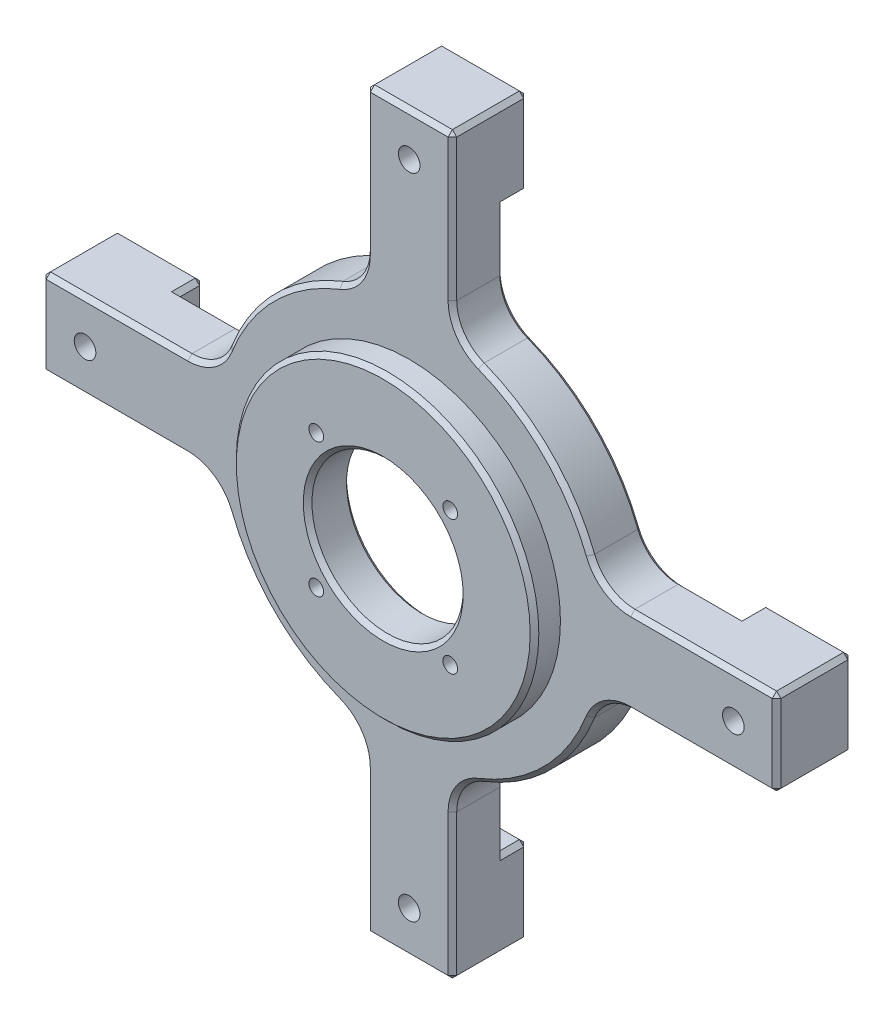
from build123d import *

# Parameters (mm, degrees)
SKETCH1_R                                           = 35
BOSS_EXTRUDE1_DEPTH                                 = 12
BOSS_EXTRUDE2_START                                 = -4
SKETCH2_R                                           = 35
SKETCH2_R_2                                         = 17.5
BOSS_EXTRUDE2_DEPTH                                 = 4
SKETCH3_W                                           = 20
SKETCH3_H                                           = 20
BOSS_EXTRUDE3_DEPTH                                 = 5.5
CIRPATTERN1_COUNT                                   = 4
CUT_EXTRUDE1_REACH                                  = 123.475
SKETCH4_R                                           = 2.5
FILLET2_R                                           = 10
SKETCH5_R                                           = 35
SKETCH5_R_2                                         = 17.5
BOSS_EXTRUDE4_DEPTH                                 = 6
CSK_FOR_M3_COUNTERSUNK_FLAT_HEAD_SCREW1_D           = 3.4
CSK_FOR_M3_COUNTERSUNK_FLAT_HEAD_SCREW1_CSINK_D     = 6.3
CSK_FOR_M3_COUNTERSUNK_FLAT_HEAD_SCREW1_CSINK_ANGLE = 90
CHAMFER1_SIZE                                       = 1
CHAMFER2_SIZE                                       = 1


with BuildPart() as part:
    # Sketch1 → Boss-Extrude1 (new body)
    with BuildSketch(Plane.XY):
        with BuildLine():
            Line((43.874821937, -10), (85, -10))
            Line((85, -10), (85, 10))
            Line((85, 10), (43.874821937, 10))
            ThreePointArc((43.874821937, 10), (31.819805153, 31.819805153), (10, 43.874821937))
            Line((10, 43.874821937), (10, 85))
            Line((10, 85), (-10, 85))
            Line((-10, 85), (-10, 43.874821937))
            ThreePointArc((-10, 43.874821937), (-31.819805153, 31.819805153), (-43.874821937, 10))
            Line((-43.874821937, 10), (-85, 10))
            Line((-85, 10), (-85, -10))
            Line((-85, -10), (-43.874821937, -10))
            ThreePointArc((-43.874821937, -10), (-31.819805153, -31.819805153), (-10, -43.874821937))
            Line((-10, -43.874821937), (-10, -85))
            Line((-10, -85), (10, -85))
            Line((10, -85), (10, -43.874821937))
            ThreePointArc((10, -43.874821937), (31.819805153, -31.819805153), (43.874821937, -10))
        make_face()
        Circle(SKETCH1_R, mode=Mode.SUBTRACT)
    extrude(amount=BOSS_EXTRUDE1_DEPTH)

    # Sketch2 → Boss-Extrude2 (add)
    with BuildSketch(Plane.XY.offset(12).offset(BOSS_EXTRUDE2_START)):
        Circle(SKETCH2_R)
        Circle(SKETCH2_R_2, mode=Mode.SUBTRACT)
    extrude(amount=BOSS_EXTRUDE2_DEPTH)

    # Sketch3 → Boss-Extrude3 (add)
    with BuildSketch(Plane.XY):
        with Locations((0, 75)):
            Rectangle(SKETCH3_W, SKETCH3_H)
    boss_extrude3 = extrude(amount=-BOSS_EXTRUDE3_DEPTH)

    # CirPattern1: Boss-Extrude3 ×4 about axis
    cirpattern1_axis = Axis((0, 0, 0), (0, 0, 1))
    for i in range(1, CIRPATTERN1_COUNT):
        add(boss_extrude3.rotate(cirpattern1_axis, i * 360 / CIRPATTERN1_COUNT))

    # Sketch4 → Cut-Extrude1 (cut, up to next)
    with BuildSketch(Plane(origin=(0, 0, -5.5), x_dir=(-1, 0, 0), z_dir=(0, 0, -1)), mode=Mode.PRIVATE) as cut_extrude1_sk1:
        with Locations((0, 75)):
            Circle(SKETCH4_R)
    cut_extrude1_tool1 = extrude(cut_extrude1_sk1.sketch, amount=-CUT_EXTRUDE1_REACH, mode=Mode.PRIVATE) & part.part
    # Sketch4 → Cut-Extrude1 (cut, up to next)
    with BuildSketch(Plane(origin=(0, 0, -5.5), x_dir=(-1, 0, 0), z_dir=(0, 0, -1)), mode=Mode.PRIVATE) as cut_extrude1_sk2:
        with Locations((-75, 0)):
            Circle(SKETCH4_R)
    cut_extrude1_tool2 = extrude(cut_extrude1_sk2.sketch, amount=-CUT_EXTRUDE1_REACH, mode=Mode.PRIVATE) & part.part
    # Sketch4 → Cut-Extrude1 (cut, up to next)
    with BuildSketch(Plane(origin=(0, 0, -5.5), x_dir=(-1, 0, 0), z_dir=(0, 0, -1)), mode=Mode.PRIVATE) as cut_extrude1_sk3:
        with Locations((0, -75)):
            Circle(SKETCH4_R)
    cut_extrude1_tool3 = extrude(cut_extrude1_sk3.sketch, amount=-CUT_EXTRUDE1_REACH, mode=Mode.PRIVATE) & part.part
    # Sketch4 → Cut-Extrude1 (cut, up to next)
    with BuildSketch(Plane(origin=(0, 0, -5.5), x_dir=(-1, 0, 0), z_dir=(0, 0, -1)), mode=Mode.PRIVATE) as cut_extrude1_sk4:
        with Locations((75, 0)):
            Circle(SKETCH4_R)
    cut_extrude1_tool4 = extrude(cut_extrude1_sk4.sketch, amount=-CUT_EXTRUDE1_REACH, mode=Mode.PRIVATE) & part.part
    add(cut_extrude1_tool1.solids().sort_by_distance((0, 75, -5.5))[0], mode=Mode.SUBTRACT)
    add(cut_extrude1_tool2.solids().sort_by_distance((75, 0, -5.5))[0], mode=Mode.SUBTRACT)
    add(cut_extrude1_tool3.solids().sort_by_distance((0, -75, -5.5))[0], mode=Mode.SUBTRACT)
    add(cut_extrude1_tool4.solids().sort_by_distance((-75, 0, -5.5))[0], mode=Mode.SUBTRACT)

    # Fillet2
    fillet2_edges = [part.edges().sort_by_distance(p)[0] for p in [
        (10, -43.874821937, 6),
        (-10, -43.874821937, 6),
        (-43.874821937, -10, 6),
        (-43.874821937, 10, 6),
        (-10, 43.874821937, 6),
        (10, 43.874821937, 6),
        (43.874821937, 10, 6),
        (43.874821937, -10, 6),
    ]]
    fillet(fillet2_edges, radius=FILLET2_R)

    # Sketch5 → Boss-Extrude4 (add)
    with BuildSketch(Plane.XY.offset(12)):
        Circle(SKETCH5_R)
        Circle(SKETCH5_R_2, mode=Mode.SUBTRACT)
    extrude(amount=BOSS_EXTRUDE4_DEPTH)

    # CSK for M3 Countersunk Flat Head Screw1 (through all)
    with Locations(Plane(origin=(-15.5, 15.5, 8), x_dir=(-1, 0, 0), z_dir=(0, 0, -1))):
        with Locations((0, 0), (-31, 0), (-31, -31), (0, -31)):
            CounterSinkHole(CSK_FOR_M3_COUNTERSUNK_FLAT_HEAD_SCREW1_D / 2, CSK_FOR_M3_COUNTERSUNK_FLAT_HEAD_SCREW1_CSINK_D / 2, counter_sink_angle=CSK_FOR_M3_COUNTERSUNK_FLAT_HEAD_SCREW1_CSINK_ANGLE)

    # Chamfer1
    chamfer1_edges = [part.edges().sort_by_distance(p)[0] for p in [
        (85, 0, 12),
        (-58.117376915, 10, 0),
        (-68.117376915, 10, 12),
        (-31.819805153, 31.819805153, 0),
        (-31.819805153, 31.819805153, 12),
        (-31.819805153, -31.819805153, 0),
        (-31.819805153, -31.819805153, 12),
        (68.117376915, 10, 12),
        (-10, -58.117376915, 0),
        (-10, -68.117376915, 12),
        (31.819805153, -31.819805153, 0),
        (31.819805153, -31.819805153, 12),
        (58.117376915, -10, 0),
        (68.117376915, -10, 12),
        (31.819805153, 31.819805153, 0),
        (31.819805153, 31.819805153, 12),
        (10, 58.117376915, 0),
        (10, 68.117376915, 12),
        (-45.593993082, 11.742771762, 0),
        (-45.593993082, 11.742771762, 12),
        (-11.742771762, 45.593993082, 0),
        (-11.742771762, 45.593993082, 12),
        (-45.593993082, -11.742771762, 0),
        (-45.593993082, -11.742771762, 12),
        (-11.742771762, -45.593993082, 0),
        (-11.742771762, -45.593993082, 12),
        (11.742771762, -45.593993082, 0),
        (11.742771762, -45.593993082, 12),
        (45.593993082, -11.742771762, 0),
        (45.593993082, -11.742771762, 12),
        (45.593993082, 11.742771762, 0),
        (45.593993082, 11.742771762, 12),
        (11.742771762, 45.593993082, 0),
        (11.742771762, 45.593993082, 12),
        (0, 85, 12),
        (-10, 68.117376915, 12),
        (10, -85, 3.25),
        (-10, -85, 3.25),
        (-85, -10, 3.25),
        (-85, 10, 3.25),
        (-10, 85, 3.25),
        (10, 85, 3.25),
        (85, 10, 3.25),
        (85, -10, 3.25),
        (-85, 0, 12),
        (-68.117376915, -10, 12),
        (0, -85, 12),
        (10, -68.117376915, 12),
        (-10, 58.117376915, 0),
        (10, 75, -5.5),
        (0, 65, -5.5),
        (10, 65, -2.75),
        (-10, 75, -5.5),
        (-10, 65, -2.75),
        (0, 85, -5.5),
        (58.117376915, 10, 0),
        (75, -10, -5.5),
        (65, 0, -5.5),
        (65, -10, -2.75),
        (75, 10, -5.5),
        (65, 10, -2.75),
        (85, 0, -5.5),
        (10, -58.117376915, 0),
        (-10, -75, -5.5),
        (0, -65, -5.5),
        (-10, -65, -2.75),
        (10, -75, -5.5),
        (10, -65, -2.75),
        (0, -85, -5.5),
        (-58.117376915, -10, 0),
        (-75, 10, -5.5),
        (-65, 0, -5.5),
        (-65, 10, -2.75),
        (-75, -10, -5.5),
        (-65, -10, -2.75),
        (-85, 0, -5.5),
    ]]
    chamfer(chamfer1_edges, length=CHAMFER1_SIZE)

    # Chamfer2
    chamfer2_edges = [part.edges().sort_by_distance(p)[0] for p in [
        (-35, 0, 18),
        (-17.5, 0, 18),
        (-35, 0, 0),
        (-17.5, 0, 8),
    ]]
    chamfer(chamfer2_edges, length=CHAMFER2_SIZE)


solid = part.part
